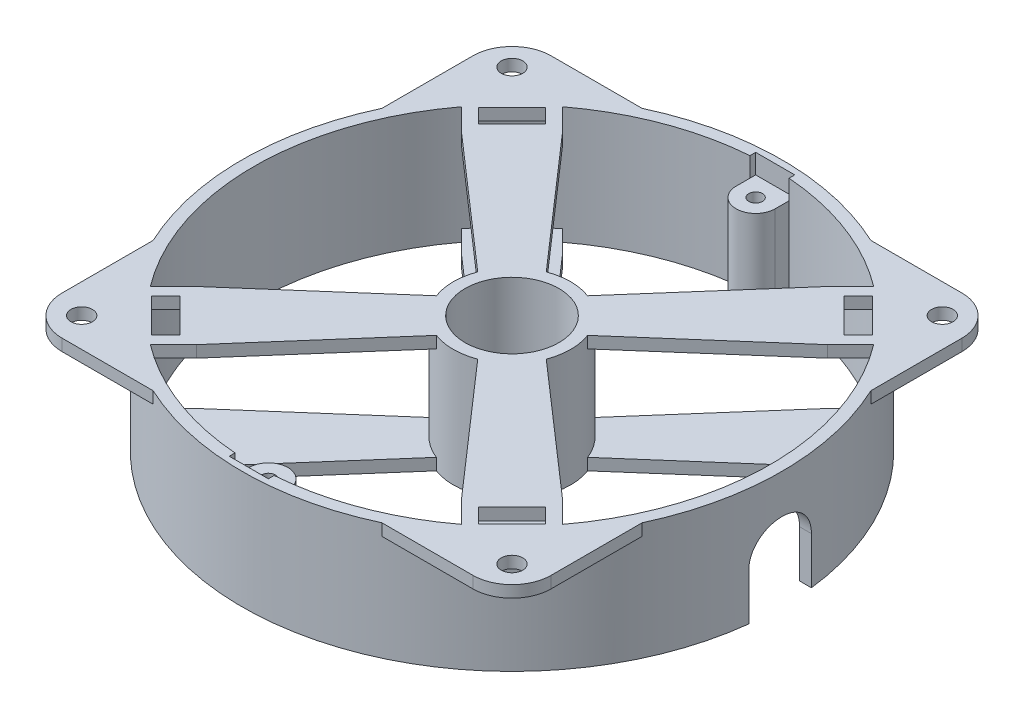
from build123d import *

# Parameters (mm, degrees)
SKETCH1_R               = 69
BOSS_EXTRUDE1_DEPTH     = 30
SKETCH2_W               = 125
SKETCH2_H               = 125
BOSS_EXTRUDE2_DEPTH     = 3
SKETCH3_R               = 2.75
CUT_EXTRUDE1_DEPTH      = 3
SKETCH4_R               = 66
CUT_EXTRUDE2_DEPTH      = 103.088197163
FILLET1_R               = 10
CUT_EXTRUDE3_DEPTH      = 103.088197163
BOSS_EXTRUDE4_DEPTH     = 30
CIRPATTERN2_COUNT       = 4
BOSS_EXTRUDE5_DEPTH     = 30
CUT_EXTRUDE4_DEPTH      = 12
CUT_EXTRUDE4_DEPTH_BACK = 12
SKETCH10_R              = 66
SKETCH11_R              = 15
BOSS_EXTRUDE6_DEPTH     = 30
SKETCH12_R              = 1.75
BOSS_EXTRUDE9_DEPTH     = 30
CUT_EXTRUDE5_START      = -25
SKETCH12_3_R            = 1.75
CUT_EXTRUDE5_DEPTH      = 5
SKETCH14_R              = 12
CUT_EXTRUDE6_DEPTH      = 103.088197329


with BuildPart() as part:
    # Sketch1 → Boss-Extrude1 (new body)
    with BuildSketch(Plane(origin=(0, 0, 0), x_dir=(1, 0, 0), z_dir=(0, 1, 0))):
        with Locations(Location((0, 0, 0), (0, 0, 270))):
            Circle(SKETCH1_R)
    extrude(amount=BOSS_EXTRUDE1_DEPTH)

    # Sketch2 → Boss-Extrude2 (add)
    with BuildSketch(Plane(origin=(0, 30, 0), x_dir=(1, 0, 0), z_dir=(0, 1, 0))):
        Rectangle(SKETCH2_W, SKETCH2_H)
    extrude(amount=-BOSS_EXTRUDE2_DEPTH)

    # Sketch3 → Cut-Extrude1 (cut)
    with BuildSketch(Plane(origin=(0, 30, 0), x_dir=(1, 0, 0), z_dir=(0, 1, 0))):
        with Locations(Location((55, 55, 0), (0, 0, 270))):
            Circle(SKETCH3_R)
        with Locations(Location((-55, 55, 0), (0, 0, 270))):
            Circle(SKETCH3_R)
        with Locations(Location((-55, -55, 0), (0, 0, 270))):
            Circle(SKETCH3_R)
        with Locations(Location((55, -55, 0), (0, 0, 270))):
            Circle(SKETCH3_R)
    extrude(amount=-CUT_EXTRUDE1_DEPTH, mode=Mode.SUBTRACT)

    # Sketch4 → Cut-Extrude2 (cut, through all)
    with BuildSketch(Plane.XZ):
        with Locations(Location((0, 0, 0), (0, 0, 270))):
            Circle(SKETCH4_R)
    extrude(amount=-CUT_EXTRUDE2_DEPTH, mode=Mode.SUBTRACT)

    # Fillet1
    fillet1_edges = [part.edges().sort_by_distance(p)[0] for p in [
        (-62.5, 28.5, 62.5),
        (-62.5, 28.5, -62.5),
        (62.5, 28.5, -62.5),
        (62.5, 28.5, 62.5),
    ]]
    fillet(fillet1_edges, radius=FILLET1_R)

    # Sketch6 → Cut-Extrude3 (cut, through all)
    with BuildSketch(Plane(origin=(0, 0, 0), x_dir=(0, 0, -1), z_dir=(1, 0, 0))):
        with BuildLine():
            Line((-8, 0), (-8, 12))
            ThreePointArc((-8, 12), (0, 20), (8, 12))
            Line((8, 12), (8, 0))
            ThreePointArc((8, 0), (0, -8), (-8, 0))
        make_face()
    extrude(amount=CUT_EXTRUDE3_DEPTH, mode=Mode.SUBTRACT)

    # Sketch8 → Boss-Extrude4 (add)
    with BuildSketch(Plane(origin=(0, 30, 0), x_dir=(1, 0, 0), z_dir=(0, 1, 0))):
        Polygon((41.790010768, 54.659354186), (33.870414819, 46.739758236), (46.739758236, 33.870414819), (54.659354186, 41.790010768), align=None)
        Polygon((41.790010768, 50.416713499), (50.416713499, 41.790010768), (46.739758236, 38.113055506), (38.113055506, 46.739758236), align=None, mode=Mode.SUBTRACT)
    boss_extrude4 = extrude(amount=-BOSS_EXTRUDE4_DEPTH)

    # CirPattern2: Boss-Extrude4 ×4 about axis
    cirpattern2_axis = Axis((0, 0, 0), (0, 1, 0))
    for i in range(1, CIRPATTERN2_COUNT):
        add(boss_extrude4.rotate(cirpattern2_axis, i * 360 / CIRPATTERN2_COUNT))

    # Sketch9 → Boss-Extrude5 (add)
    with BuildSketch(Plane(origin=(0, 30, 0), x_dir=(1, 0, 0), z_dir=(0, 1, 0))):
        Polygon((46.739758236, 33.870414819), (33.870414819, 46.739758236), (0, 8), (-33.870414819, 46.739758236), (-46.739758236, 33.870414819), (-8, 0), (-46.739758236, -33.870414819), (-33.870414819, -46.739758236), (0, -8), (33.870414819, -46.739758236), (46.739758236, -33.870414819), (8, 0), align=None)
    extrude(amount=-BOSS_EXTRUDE5_DEPTH)

    # Sketch10 → Cut-Extrude4 (cut, two sides: drawn at the far end of the back side and taken through both)
    with BuildSketch(Plane(origin=(0, 15, 0), x_dir=(1, 0, 0), z_dir=(0, 1, 0)).offset(-CUT_EXTRUDE4_DEPTH_BACK)):
        with Locations(Location((0, 0, 0), (0, 0, 52.925119379))):
            Circle(SKETCH10_R)
    extrude(amount=CUT_EXTRUDE4_DEPTH + CUT_EXTRUDE4_DEPTH_BACK, mode=Mode.SUBTRACT)

    # Sketch11 → Boss-Extrude6 (add)
    with BuildSketch(Plane.XZ):
        with Locations(Location((0, 0, 0), (0, 0, 290.612180744))):
            Circle(SKETCH11_R)
    extrude(amount=-BOSS_EXTRUDE6_DEPTH)

    # Sketch12 → Boss-Extrude9 (add)
    with BuildSketch(Plane.XZ):
        with BuildLine():
            Line((5, 62.278453748), (5, 67.278453748))
            Line((5, 67.278453748), (-5, 67.278453748))
            Line((-5, 67.278453748), (-5, 62.278453748))
            ThreePointArc((-5, 62.278453748), (0, 57.278453748), (5, 62.278453748))
        make_face()
        with Locations(Location((0, 62.278453748, 0), (0, 0, 270))):
            Circle(SKETCH12_R, mode=Mode.SUBTRACT)
    boss_extrude9 = extrude(amount=-BOSS_EXTRUDE9_DEPTH)

    # Mirror1: Boss-Extrude9 across plane
    add(boss_extrude9.mirror(Plane.XY))

    # Sketch12<3> → Cut-Extrude5 (cut)
    with BuildSketch(Plane.XZ.offset(CUT_EXTRUDE5_START)):
        with BuildLine():
            Line((5, 62.278453748), (5, 67.278453748))
            Line((5, 67.278453748), (-5, 67.278453748))
            Line((-5, 67.278453748), (-5, 62.278453748))
            ThreePointArc((-5, 62.278453748), (0, 57.278453748), (5, 62.278453748))
        make_face()
        with Locations(Location((0, 62.278453748, 0), (0, 0, 270))):
            Circle(SKETCH12_3_R, mode=Mode.SUBTRACT)
    cut_extrude5 = extrude(amount=-CUT_EXTRUDE5_DEPTH, mode=Mode.SUBTRACT)

    # Mirror2: Cut-Extrude5 across plane
    add(cut_extrude5.mirror(Plane.XY), mode=Mode.SUBTRACT)

    # Sketch14 → Cut-Extrude6 (cut, through all)
    with BuildSketch(Plane(origin=(0, 30, 0), x_dir=(1, 0, 0), z_dir=(0, 1, 0))):
        with Locations(Location((0, 0, 0), (0, 0, 270))):
            Circle(SKETCH14_R)
    extrude(amount=-CUT_EXTRUDE6_DEPTH, mode=Mode.SUBTRACT)


solid = part.part
